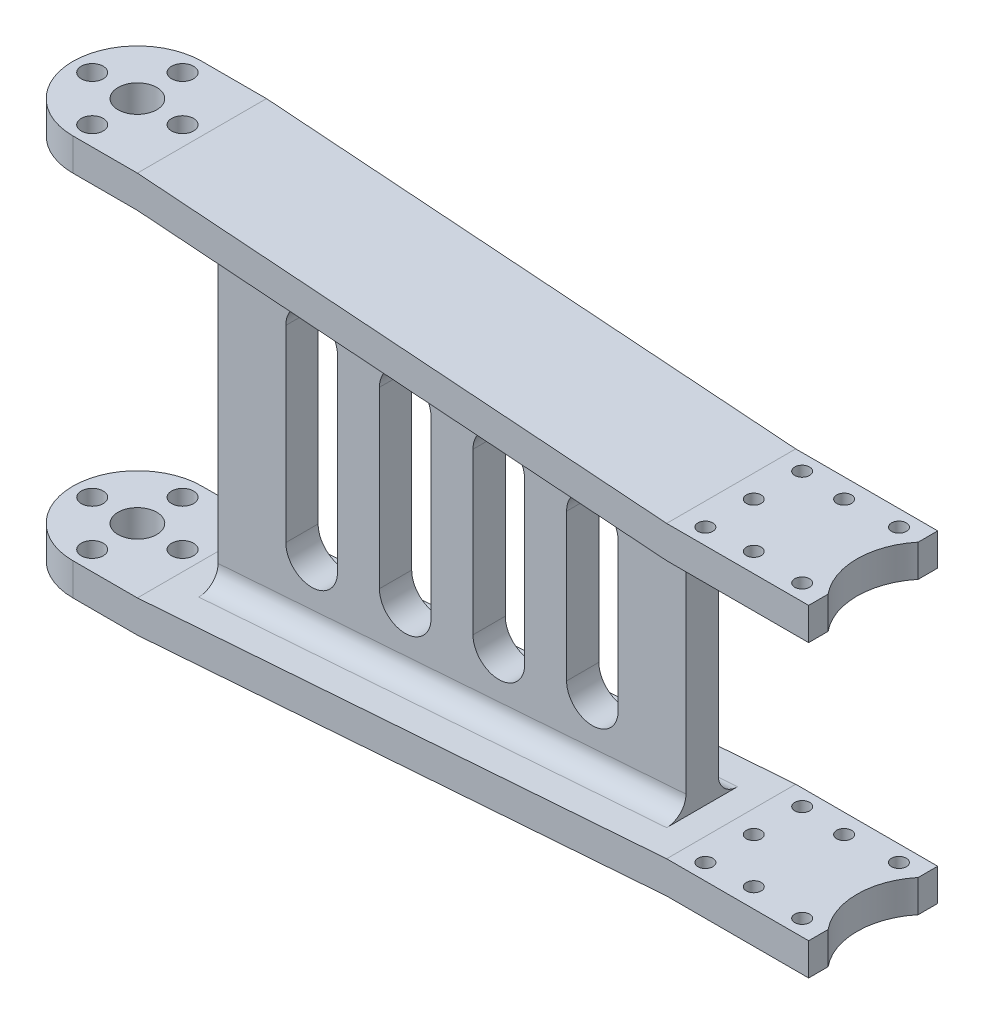
from build123d import *

# Parameters (mm, degrees)
SKETCH_1_R           = 1.15
SKETCH_1_R_2         = 1.7
SKETCH_1_R_3         = 3
EXTRUDE_1_DEPTH      = 11
EXTRUDE_START        = 51
SKETCH_1_3_R         = 1.15
SKETCH_1_3_R_2       = 1.7
SKETCH_1_3_R_3       = 3
EXTRUDE_2_DEPTH      = 11
CUT_EXTRUDE_1_DEPTH  = 132.301180497
EXTRUDE_4_DEPTH      = 2.5
EXTRUDE_4_DEPTH_BACK = 2.5
CUT_EXTRUDE_2_DEPTH  = 131.369666717
FILLET_1_R           = 3


with BuildPart() as part:
    # 草图1 → 凸台-拉伸1 (new body)
    with BuildSketch(Plane(origin=(0, 0, 0), x_dir=(1, 0, 0), z_dir=(0, 1, 0))):
        with BuildLine():
            Line((114, 10), (0, 10))
            ThreePointArc((0, 10), (-10, 0), (0, -10))
            Line((0, -10), (114, -10))
            Line((114, -10), (114, -6.982120022))
            ThreePointArc((114, -6.982120022), (111.5, 0), (114, 6.982120022))
            Line((114, 6.982120022), (114, 10))
        make_face()
        with Locations((95.5, -7.5)):
            Circle(SKETCH_1_R, mode=Mode.SUBTRACT)
        with Locations((102.5, -7)):
            Circle(SKETCH_1_R, mode=Mode.SUBTRACT)
        with Locations((110.5, -7.5)):
            Circle(SKETCH_1_R, mode=Mode.SUBTRACT)
        with Locations((95.5, 0)):
            Circle(SKETCH_1_R, mode=Mode.SUBTRACT)
        with Locations((95.5, 7.5)):
            Circle(SKETCH_1_R, mode=Mode.SUBTRACT)
        with Locations((102.5, 7)):
            Circle(SKETCH_1_R, mode=Mode.SUBTRACT)
        with Locations((110.5, 7.5)):
            Circle(SKETCH_1_R, mode=Mode.SUBTRACT)
        with Locations((7, 0)):
            Circle(SKETCH_1_R_2, mode=Mode.SUBTRACT)
        with Locations((0, 7)):
            Circle(SKETCH_1_R_2, mode=Mode.SUBTRACT)
        with Locations((0, -7)):
            Circle(SKETCH_1_R_2, mode=Mode.SUBTRACT)
        with Locations((-7, 0)):
            Circle(SKETCH_1_R_2, mode=Mode.SUBTRACT)
        Circle(SKETCH_1_R_3, mode=Mode.SUBTRACT)
    extrude(amount=EXTRUDE_1_DEPTH)


with BuildPart() as body_2:
    # 草图1<3> → 凸台-拉伸2 (new body)
    with BuildSketch(Plane(origin=(0, 0, 0), x_dir=(1, 0, 0), z_dir=(0, 1, 0)).offset(EXTRUDE_START)):
        with BuildLine():
            Line((114, 10), (0, 10))
            ThreePointArc((0, 10), (-10, 0), (0, -10))
            Line((0, -10), (114, -10))
            Line((114, -10), (114, -6.982120022))
            ThreePointArc((114, -6.982120022), (111.5, 0), (114, 6.982120022))
            Line((114, 6.982120022), (114, 10))
        make_face()
        with Locations((95.5, -7.5)):
            Circle(SKETCH_1_3_R, mode=Mode.SUBTRACT)
        with Locations((102.5, -7)):
            Circle(SKETCH_1_3_R, mode=Mode.SUBTRACT)
        with Locations((110.5, -7.5)):
            Circle(SKETCH_1_3_R, mode=Mode.SUBTRACT)
        with Locations((95.5, 0)):
            Circle(SKETCH_1_3_R, mode=Mode.SUBTRACT)
        with Locations((95.5, 7.5)):
            Circle(SKETCH_1_3_R, mode=Mode.SUBTRACT)
        with Locations((102.5, 7)):
            Circle(SKETCH_1_3_R, mode=Mode.SUBTRACT)
        with Locations((110.5, 7.5)):
            Circle(SKETCH_1_3_R, mode=Mode.SUBTRACT)
        with Locations((7, 0)):
            Circle(SKETCH_1_3_R_2, mode=Mode.SUBTRACT)
        with Locations((0, 7)):
            Circle(SKETCH_1_3_R_2, mode=Mode.SUBTRACT)
        with Locations((0, -7)):
            Circle(SKETCH_1_3_R_2, mode=Mode.SUBTRACT)
        with Locations((-7, 0)):
            Circle(SKETCH_1_3_R_2, mode=Mode.SUBTRACT)
        Circle(SKETCH_1_3_R_3, mode=Mode.SUBTRACT)
    extrude(amount=EXTRUDE_2_DEPTH)


with BuildPart() as cut_extrude_1_tool:
    # 草图4 → 切除-拉伸1 (new, through all)
    with BuildSketch(Plane.XY.offset(10)):
        Polygon((-10, 57), (-10, 5), (10, 5), (92, 11), (114, 11), (114, 51), (92, 51), (10, 57), align=None)
        Polygon((114, 62), (10, 62), (92, 56), (114, 56), align=None)
        Polygon((92, 6), (10, 0), (114, 0), (114, 6), align=None)
    extrude(amount=-CUT_EXTRUDE_1_DEPTH)


with BuildPart() as part_1:
    add(part.part)

    # 切除-拉伸1: cut by cut_extrude_1_tool
    add(cut_extrude_1_tool.part, mode=Mode.SUBTRACT)



with BuildPart() as body_2_1:
    add(body_2.part)

    # 切除-拉伸1: cut by cut_extrude_1_tool
    add(cut_extrude_1_tool.part, mode=Mode.SUBTRACT)


with BuildPart() as part_2:
    add(part_1.part)

    add(body_2_1.part)  # 凸台-拉伸4 merges body 2
    # 草图5 → 凸台-拉伸4 (add, two sides: drawn at the far end of the back side and taken through both)
    with BuildSketch(Plane.XY.offset(-EXTRUDE_4_DEPTH_BACK)):
        Polygon((15, 56.634146341), (15, 5.365853659), (87.5, 10.670731707), (87.5, 51.329268293), align=None)
    extrude(amount=EXTRUDE_4_DEPTH + EXTRUDE_4_DEPTH_BACK)

    # 草图9 → 切除-拉伸2 (cut, through all)
    with BuildSketch(Plane.XY.offset(2.5)):
        with BuildLine():
            Line((33.5, 45.573170732), (33.5, 16.426829268))
            ThreePointArc((33.5, 16.426829268), (29.5, 12.426829268), (25.5, 16.426829268))
            Line((25.5, 16.426829268), (25.5, 45.573170732))
            ThreePointArc((25.5, 45.573170732), (29.5, 49.573170732), (33.5, 45.573170732))
        make_face()
        with BuildLine():
            Line((48, 44.512195122), (48, 17.487804878))
            ThreePointArc((48, 17.487804878), (44, 13.487804878), (40, 17.487804878))
            Line((40, 17.487804878), (40, 44.512195122))
            ThreePointArc((40, 44.512195122), (44, 48.512195122), (48, 44.512195122))
        make_face()
        with BuildLine():
            Line((62.5, 43.451219512), (62.5, 18.548780488))
            ThreePointArc((62.5, 18.548780488), (58.5, 14.548780488), (54.5, 18.548780488))
            Line((54.5, 18.548780488), (54.5, 43.451219512))
            ThreePointArc((54.5, 43.451219512), (58.5, 47.451219512), (62.5, 43.451219512))
        make_face()
        with BuildLine():
            Line((77, 42.390243902), (77, 19.609756098))
            ThreePointArc((77, 19.609756098), (73, 15.609756098), (69, 19.609756098))
            Line((69, 19.609756098), (69, 42.390243902))
            ThreePointArc((69, 42.390243902), (73, 46.390243902), (77, 42.390243902))
        make_face()
    extrude(amount=-CUT_EXTRUDE_2_DEPTH, mode=Mode.SUBTRACT)

    # 圆角1
    fillet_1_edges = [part_2.edges().sort_by_distance(p)[0] for p in [
        (51.25, 8.018292683, -2.5),
        (51.25, 53.981707317, -2.5),
        (51.25, 53.981707317, 2.5),
        (51.25, 8.018292683, 2.5),
    ]]
    fillet(fillet_1_edges, radius=FILLET_1_R)


solid = part_2.part
